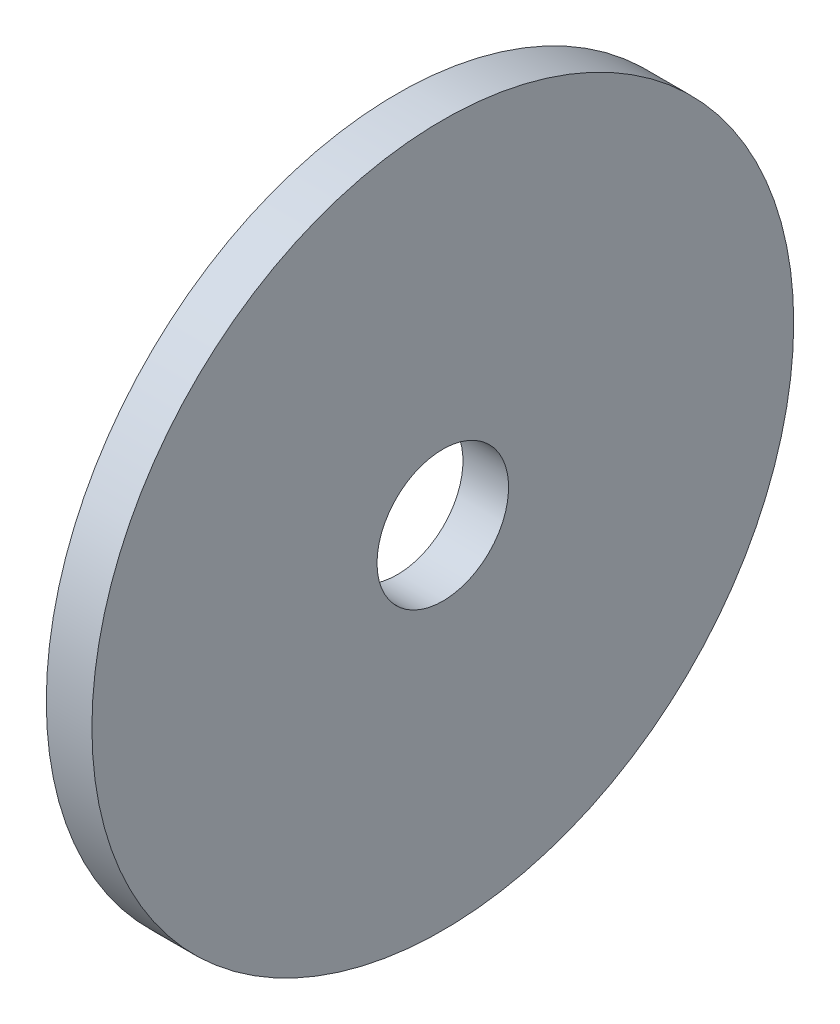
from build123d import *

# Parameters (mm, degrees)
SKETCH1_R           = 12.7
SKETCH1_R_2         = 2.38125
BOSS_EXTRUDE1_DEPTH = 1.651


with BuildPart() as part:
    # Sketch1 → Boss-Extrude1 (new body)
    with BuildSketch(Plane(origin=(0, 0, 0), x_dir=(0, 0, -1), z_dir=(1, 0, 0))):
        with Locations(Location((0, 0, 0), (0, 0, 180))):
            Circle(SKETCH1_R)
        with Locations(Location((0, 0, 0), (0, 0, 180))):
            Circle(SKETCH1_R_2, mode=Mode.SUBTRACT)
    extrude(amount=BOSS_EXTRUDE1_DEPTH)


solid = part.part
